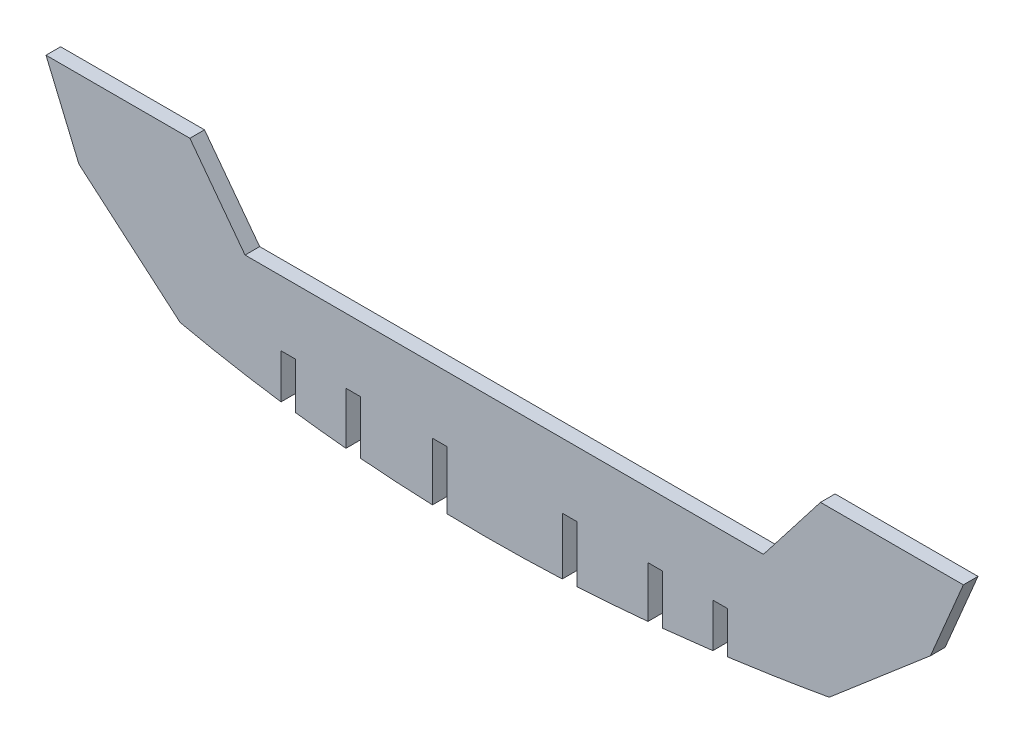
from build123d import *

# Parameters (mm, degrees)
SKETCH1_W           = 152.4
SKETCH1_H           = 38.1
BOSS_EXTRUDE1_DEPTH = 4.2926
SKETCH2_W           = 152.142509963
SKETCH2_H           = 11.43
CUT_EXTRUDE1_DEPTH  = 4.2926
SKETCH3_W           = 4.2926
SKETCH3_H           = 20.32
CUT_EXTRUDE2_DEPTH  = 4.2926


with BuildPart() as part:
    # Sketch1 → Boss-Extrude1 (new body)
    with BuildSketch(Plane.XY):
        Polygon((-83.82, 29.21), (-134.62, 29.21), (-124.968, 6.35), (-95.25, -19.05), (-76.2, -19.05), (-76.2, 19.05), align=None)
        Rectangle(SKETCH1_W, SKETCH1_H)
        with BuildLine():
            Line((-76.2, -19.05), (-95.25, -19.05))
            add(Edge.make_bspline(
                [(-95.25, -19.05), (-66.079235011, -25.514680938), (-2.12159074, -32.083739423), (61.761861898, -25.010246771), (95.25, -19.05)],
                knots=[0, 0, 0, 0, 0.467198678, 1, 1, 1, 1], degree=3))
            Line((95.25, -19.05), (76.2, -19.05))
            Line((76.2, -19.05), (-76.2, -19.05))
        make_face()
        Polygon((95.25, -19.05), (76.2, -19.05), (76.2, 19.05), (83.82, 29.21), (134.62, 29.21), (124.968, 6.35), align=None)
    extrude(amount=BOSS_EXTRUDE1_DEPTH)

    # Sketch2 → Cut-Extrude1 (cut)
    with BuildSketch(Plane.XY.offset(4.2926)):
        with Locations((-0.128745018, 13.335)):
            Rectangle(SKETCH2_W, SKETCH2_H)
    extrude(amount=-CUT_EXTRUDE1_DEPTH, mode=Mode.SUBTRACT)

    # Sketch3 → Cut-Extrude2 (cut)
    with BuildSketch(Plane.XY.offset(4.2926)):
        with Locations((-63.5, -21.59)):
            Rectangle(SKETCH3_W, SKETCH3_H)
        with Locations((-44.45, -21.59)):
            Rectangle(SKETCH3_W, SKETCH3_H)
        with Locations((-19.05, -21.59)):
            Rectangle(SKETCH3_W, SKETCH3_H)
        with Locations((44.192509963, -21.59)):
            Rectangle(SKETCH3_W, SKETCH3_H)
        with Locations((63.242509963, -21.59)):
            Rectangle(SKETCH3_W, SKETCH3_H)
        with Locations((19.05, -21.59)):
            Rectangle(SKETCH3_W, SKETCH3_H)
        Polygon((-92.3925, 29.21), (-76.2, 7.62), (-76.2, 19.05), (-83.82, 29.21), align=None)
        Polygon((75.942509963, 7.62), (92.682176292, 29.21), (83.82, 29.21), (75.942509963, 19.05), align=None)
    extrude(amount=-CUT_EXTRUDE2_DEPTH, mode=Mode.SUBTRACT)


solid = part.part
